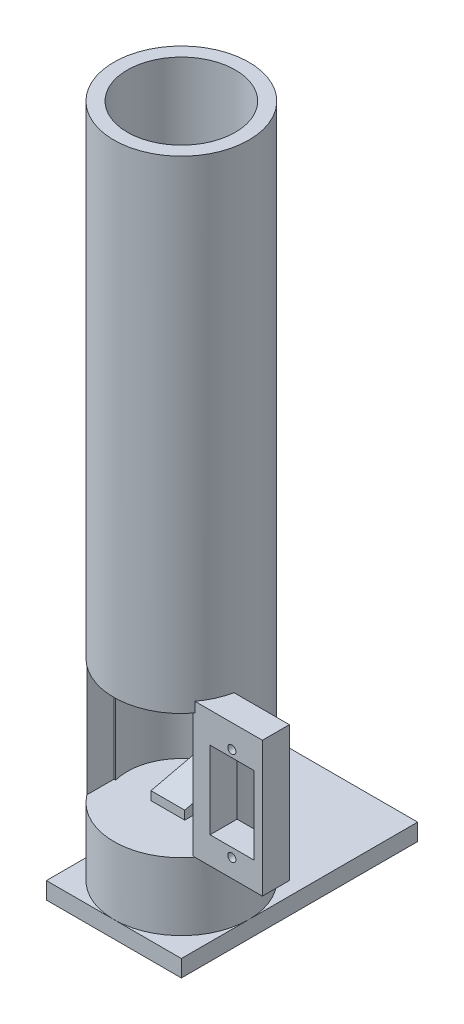
from build123d import *

# Parameters (mm, degrees)
SKETCH1_W                = 40
SKETCH1_H                = 40
BOSS_EXTRUDE1_DEPTH      = 5
SKETCH2_R                = 20
BOSS_EXTRUDE2_DEPTH      = 20
BOSS_EXTRUDE3_DEPTH      = 5
SKETCH6_R                = 20
SKETCH6_R_2              = 16
EXTRUDE_THIN1_DEPTH      = 180
SKETCH7_W                = 32
SKETCH7_H                = 37
CUT_EXTRUDE1_DEPTH       = 16
BOSS_EXTRUDE4_DEPTH      = 0.5
BOSS_EXTRUDE4_DEPTH_BACK = 20
SKETCH8_W                = 8
SKETCH8_H                = 40
SKETCH12_W               = 40
SKETCH12_H               = 5
BOSS_EXTRUDE5_DEPTH      = 30
SKETCH10_W               = 13
SKETCH10_H               = 23
CUT_EXTRUDE2_DEPTH       = 20
SKETCH11_R               = 1.2
CUT_EXTRUDE3_DEPTH       = 10


with BuildPart() as part:
    # Sketch1 → Boss-Extrude1 (new body)
    with BuildSketch(Plane(origin=(0, 0, 0), x_dir=(1, 0, 0), z_dir=(0, 1, 0))):
        with Locations((20, -20)):
            Rectangle(SKETCH1_W, SKETCH1_H)
    extrude(amount=BOSS_EXTRUDE1_DEPTH)

    # Sketch2 → Boss-Extrude2 (add)
    with BuildSketch(Plane(origin=(0, 5, 0), x_dir=(1, 0, 0), z_dir=(0, 1, 0))):
        with Locations(Location((20, -20, 0), (0, 0, 270))):
            Circle(SKETCH2_R)
    extrude(amount=BOSS_EXTRUDE2_DEPTH)

    # Sketch4 → Boss-Extrude3 (add, symmetric)
    with BuildSketch(Plane.ZY.offset(-20)):
        Polygon((35, 25), (5, 25), (5, 32), align=None)
    extrude(amount=BOSS_EXTRUDE3_DEPTH, both=True)

    # Sketch6 → Extrude-Thin1 (add)
    with BuildSketch(Plane(origin=(0, 25, 0), x_dir=(1, 0, 0), z_dir=(0, 1, 0))):
        with Locations((20, -20)):
            Circle(SKETCH6_R)
        with Locations((20, -20)):
            Circle(SKETCH6_R_2, mode=Mode.SUBTRACT)
    extrude(amount=EXTRUDE_THIN1_DEPTH)

    # Sketch7 → Cut-Extrude1 (cut)
    with BuildSketch(Plane.XY.offset(40)):
        with Locations((20, 43.5)):
            Rectangle(SKETCH7_W, SKETCH7_H)
    extrude(amount=-CUT_EXTRUDE1_DEPTH, mode=Mode.SUBTRACT)

    # Sketch8 → Boss-Extrude4 (add, two sides: drawn at the far end of the back side and taken through both)
    with BuildSketch(Plane.ZY.offset(-36).offset(-BOSS_EXTRUDE4_DEPTH_BACK)):
        with Locations((28, 45)):
            Rectangle(SKETCH8_W, SKETCH8_H)
    extrude(amount=BOSS_EXTRUDE4_DEPTH + BOSS_EXTRUDE4_DEPTH_BACK)

    # Sketch12 → Boss-Extrude5 (add)
    with BuildSketch(Plane(origin=(0, 0, 0), x_dir=(-1, 0, 0), z_dir=(0, 0, -1))):
        with Locations((-20, 2.5)):
            Rectangle(SKETCH12_W, SKETCH12_H)
    extrude(amount=BOSS_EXTRUDE5_DEPTH)

    # Sketch10 → Cut-Extrude2 (cut)
    with BuildSketch(Plane.XY.offset(32)):
        with Locations((47, 44.5)):
            Rectangle(SKETCH10_W, SKETCH10_H)
    extrude(amount=-CUT_EXTRUDE2_DEPTH, mode=Mode.SUBTRACT)

    # Sketch11 → Cut-Extrude3 (cut)
    with BuildSketch(Plane.XY.offset(32)):
        with Locations((46.95, 30.4)):
            Circle(SKETCH11_R)
        with Locations((46.95, 58.1)):
            Circle(SKETCH11_R)
    extrude(amount=-CUT_EXTRUDE3_DEPTH, mode=Mode.SUBTRACT)


solid = part.part
